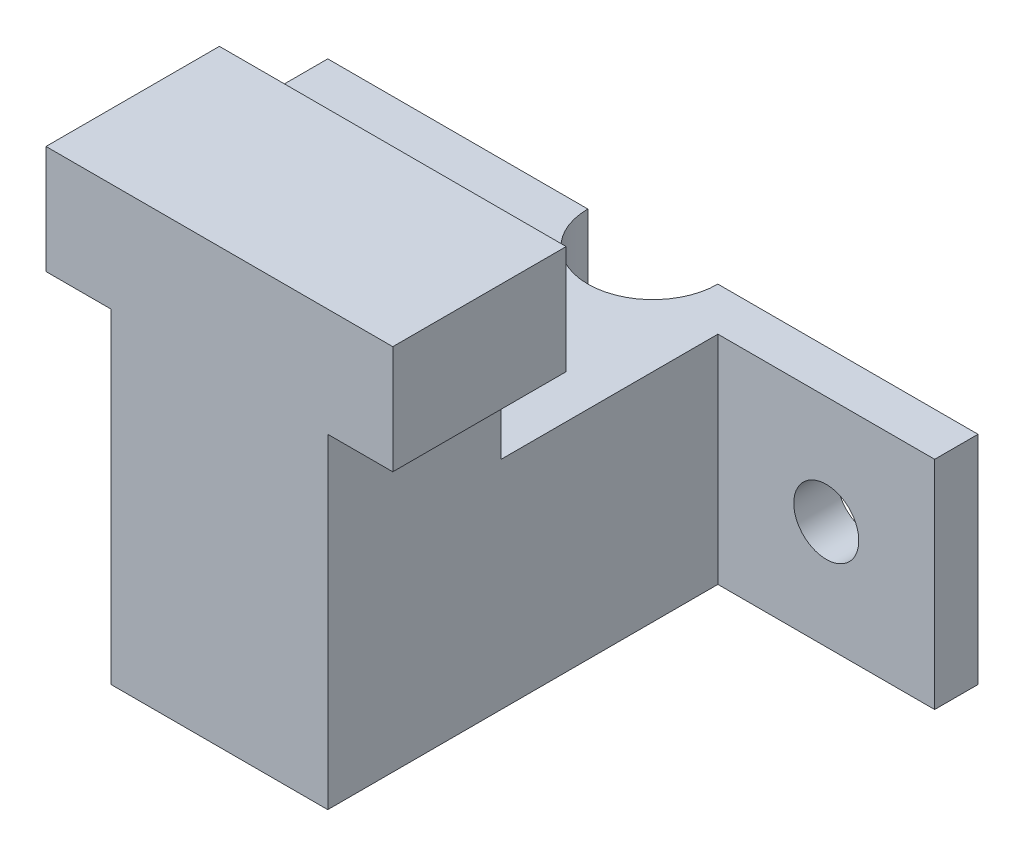
from build123d import *

# Parameters (mm, degrees)
SKETCH3_W           = 16
SKETCH3_H           = 20
BOSS_EXTRUDE1_DEPTH = 8
SKETCH4_W           = 3
SKETCH4_H           = 15
CUT_EXTRUDE1_DEPTH  = 8
SKETCH5_W           = 10
SKETCH5_H           = 10
BOSS_EXTRUDE2_DEPTH = 12
SKETCH6_R           = 3
CUT_EXTRUDE2_DEPTH  = 14
SKETCH8_W           = 2
SKETCH8_H           = 10
BOSS_EXTRUDE3_DEPTH = 10
SKETCH9_W           = 2
SKETCH9_H           = 10
BOSS_EXTRUDE4_DEPTH = 10
SKETCH10_R          = 1.5
CUT_EXTRUDE3_DEPTH  = 10


with BuildPart() as part:
    # Sketch3 → Boss-Extrude1 (new body)
    with BuildSketch(Plane.XY):
        Rectangle(SKETCH3_W, SKETCH3_H)
    extrude(amount=BOSS_EXTRUDE1_DEPTH)

    # Sketch4 → Cut-Extrude1 (cut)
    with BuildSketch(Plane.XY.offset(8)):
        with Locations((-6.5, -2.5)):
            Rectangle(SKETCH4_W, SKETCH4_H)
        with Locations((6.5, -2.5)):
            Rectangle(SKETCH4_W, SKETCH4_H)
    extrude(amount=-CUT_EXTRUDE1_DEPTH, mode=Mode.SUBTRACT)

    # Sketch5 → Boss-Extrude2 (add)
    with BuildSketch(Plane(origin=(0, 0, 0), x_dir=(-1, 0, 0), z_dir=(0, 0, -1))):
        with Locations((0, -5)):
            Rectangle(SKETCH5_W, SKETCH5_H)
    extrude(amount=BOSS_EXTRUDE2_DEPTH)

    # Sketch6 → Cut-Extrude2 (cut)
    with BuildSketch(Plane.XZ.offset(10)):
        with Locations((0, -12)):
            Circle(SKETCH6_R)
    extrude(amount=-CUT_EXTRUDE2_DEPTH, mode=Mode.SUBTRACT)

    # Sketch8 → Boss-Extrude3 (add)
    with BuildSketch(Plane(origin=(5, 0, 0), x_dir=(0, 0, -1), z_dir=(1, 0, 0))):
        with Locations((11, -5)):
            Rectangle(SKETCH8_W, SKETCH8_H)
    extrude(amount=BOSS_EXTRUDE3_DEPTH)

    # Sketch9 → Boss-Extrude4 (add)
    with BuildSketch(Plane.ZY.offset(5)):
        with Locations((-11, -5)):
            Rectangle(SKETCH9_W, SKETCH9_H)
    extrude(amount=BOSS_EXTRUDE4_DEPTH)

    # Sketch10 → Cut-Extrude3 (cut)
    with BuildSketch(Plane(origin=(0, 0, -12), x_dir=(-1, 0, 0), z_dir=(0, 0, -1))):
        with Locations((-10, -5)):
            Circle(SKETCH10_R)
        with Locations((10, -5)):
            Circle(SKETCH10_R)
    extrude(amount=-CUT_EXTRUDE3_DEPTH, mode=Mode.SUBTRACT)


solid = part.part
